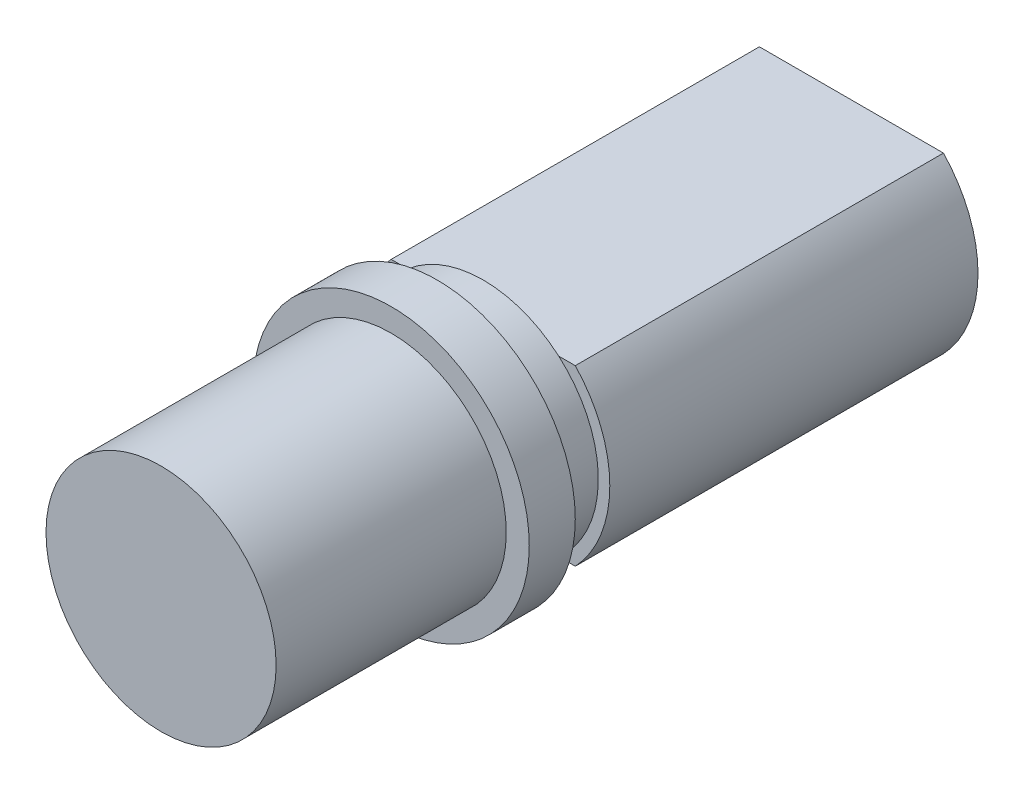
from build123d import *

# Parameters (mm, degrees)
SKETCH_1_R      = 2.5
EXTRUDE_1_DEPTH = 6.2
EXTRUDE_2_DEPTH = 8
SKETCH_3_R      = 2.5
EXTRUDE_3_DEPTH = 0.8
EXTRUDE_START   = 1
SKETCH_4_R      = 3
EXTRUDE_4_DEPTH = 1


with BuildPart() as part:
    # 草图1 → 凸台-拉伸1 (new body)
    with BuildSketch(Plane.XY):
        with Locations(Location((0, 0, 0), (0, 0, 180))):
            Circle(SKETCH_1_R)
    extrude(amount=EXTRUDE_1_DEPTH)

    # 草图2 → 凸台-拉伸2 (add)
    with BuildSketch(Plane(origin=(0, 0, 0), x_dir=(-1, 0, 0), z_dir=(0, 0, -1))):
        with BuildLine():
            Line((-2, 1.887458609), (2, 1.887458609))
            ThreePointArc((2, 1.887458609), (2.75, 0), (2, -1.887458609))
            Line((2, -1.887458609), (-2, -1.887458609))
            ThreePointArc((-2, -1.887458609), (-2.75, 0), (-2, 1.887458609))
        make_face()
    extrude(amount=EXTRUDE_2_DEPTH)

    # 草图3 → 凸台-拉伸3 (add)
    with BuildSketch(Plane.XY.offset(6.2)):
        with Locations(Location((0, 0, 0), (0, 0, 130.976076876))):
            Circle(SKETCH_3_R)
    extrude(amount=EXTRUDE_3_DEPTH)

    # 草图4 → 凸台-拉伸4 (add)
    with BuildSketch(Plane.XY.offset(EXTRUDE_START)):
        Circle(SKETCH_4_R)
    extrude(amount=EXTRUDE_4_DEPTH)


solid = part.part
